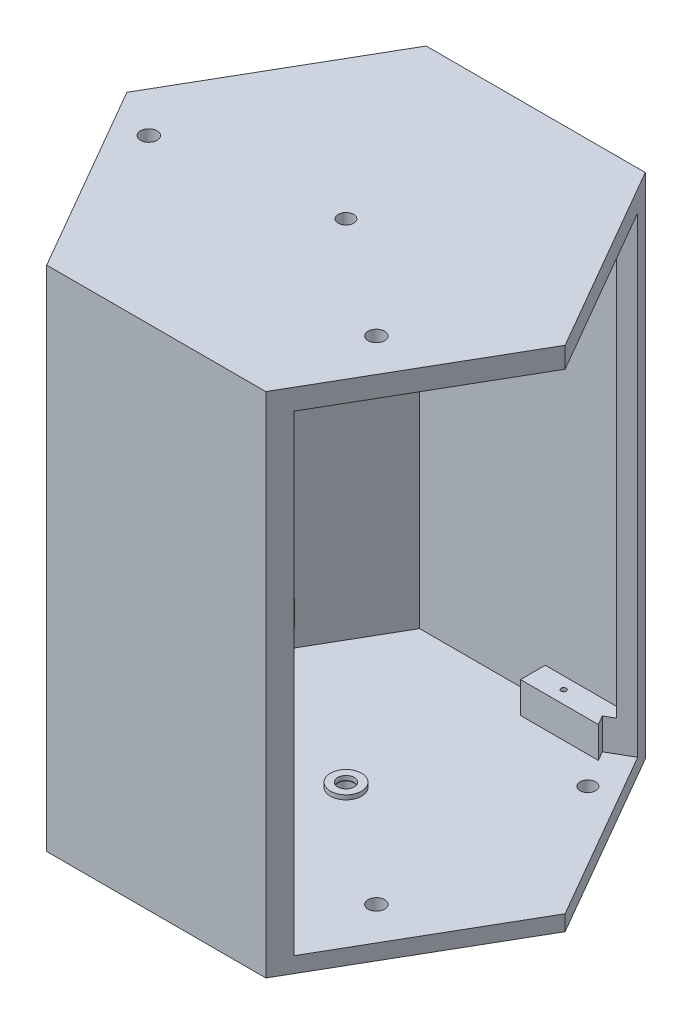
from build123d import *

# Parameters (mm, degrees)
SKETCH1_R                = 2.971068709
BOSS_EXTRUDE2_DEPTH      = 6
BOSS_EXTRUDE3_DEPTH      = 190
SKETCH3_R                = 2.971068709
BOSS_EXTRUDE5_DEPTH      = 6
SKETCH4_W                = 12.5
SKETCH4_H                = 10
BOSS_EXTRUDE6_DEPTH      = 11
SKETCH5_R                = 1
BOSS_EXTRUDE8_DEPTH      = 18
SKETCH5_2_R              = 1
CUT_EXTRUDE2_DEPTH       = 18
SKETCH7_R                = 6
SKETCH7_R_2              = 3.2
BOSS_EXTRUDE9_DEPTH      = 7.7
BOSS_EXTRUDE10_START     = -7.7
SKETCH8_R                = 6
SKETCH8_R_2              = 3.2
BOSS_EXTRUDE10_DEPTH     = 7.7
SKETCH9_W                = 182
SKETCH9_H                = 76.559305207
CUT_EXTRUDE3_DEPTH       = 6
SKETCH11_W               = 29
SKETCH11_H               = 25
CUT_EXTRUDE5_DEPTH       = 6
SKETCH12_W               = 29
SKETCH12_H               = 25
CUT_EXTRUDE6_DEPTH       = 6
SKETCH13_R               = 3.2
SKETCH13_R_2             = 3
CUT_EXTRUDE7_DEPTH       = 6
SKETCH14_R               = 3.2
CUT_EXTRUDE8_DEPTH       = 1273.798581799
SKETCH15_R               = 1
CUT_EXTRUDE9_DEPTH       = 11
SKETCH17_R               = 3
CUT_EXTRUDE11_DEPTH      = 170
CUT_EXTRUDE13_DEPTH      = 1271.151262578
CUT_EXTRUDE13_DEPTH_BACK = 1271.151262578
SKETCH19_R               = 3.2
SKETCH20_W               = 182
SKETCH20_H               = 76.559305207
CUT_EXTRUDE14_DEPTH      = 10


with BuildPart() as part:
    # Sketch1 → Boss-Extrude2 (new body)
    with BuildSketch(Plane(origin=(0, 0, 0), x_dir=(1, 0, 0), z_dir=(0, 1, 0))):
        Polygon((-40.573914373, 73.899203379), (-82.853566976, 0.668696943), (-40.573914373, -72.561809493), (43.985390835, -72.561809493), (86.265043438, 0.668696943), (43.985390835, 73.899203379), align=None)
        with Locations(Location((1.705738231, 0.668696943, 0), (0, 0, 270))):
            Circle(SKETCH1_R, mode=Mode.SUBTRACT)
    extrude(amount=BOSS_EXTRUDE2_DEPTH)

    # Sketch1<3> → Boss-Extrude3 (add)
    with BuildSketch(Plane(origin=(0, 0, 0), x_dir=(1, 0, 0), z_dir=(0, 1, 0))):
        Polygon((86.265043438, 0.668696943), (43.985390835, 73.899203379), (-40.573914373, 73.899203379), (-82.853566976, 0.668696943), (-40.573914373, -72.561809493), (43.985390835, -72.561809493), align=None)
        Polygon((-37.109812757, 67.899203379), (-75.925363746, 0.668696943), (-37.109812757, -66.561809493), (40.521289219, -66.561809493), (79.336840208, 0.668696943), (40.521289219, 67.899203379), align=None, mode=Mode.SUBTRACT)
    extrude(amount=BOSS_EXTRUDE3_DEPTH)

    # Sketch3 → Boss-Extrude5 (add)
    with BuildSketch(Plane(origin=(0, 190, 0), x_dir=(1, 0, 0), z_dir=(0, 1, 0))):
        Polygon((86.265043438, 0.668696943), (43.985390835, 73.899203379), (-40.573914373, 73.899203379), (-82.853566976, 0.668696943), (-40.573914373, -72.561809493), (43.985390835, -72.561809493), align=None)
        with Locations(Location((1.705738231, 0.668696943, 0), (0, 0, 270))):
            Circle(SKETCH3_R, mode=Mode.SUBTRACT)
    extrude(amount=BOSS_EXTRUDE5_DEPTH)

    # Sketch4 → Boss-Extrude6 (add)
    with BuildSketch(Plane(origin=(-62.429729502, 0, -36.043821133), x_dir=(-0.5000000000000001, 0, 0.8660254037844386), z_dir=(-0.8660254037844386, 0, -0.5000000000000001))):
        with Locations((2.755177243, 21.3)):
            Rectangle(SKETCH4_W, SKETCH4_H)
    extrude(amount=-BOSS_EXTRUDE6_DEPTH)

    # Sketch5 → Boss-Extrude8 (add)
    with BuildSketch(Plane.XZ):
        Polygon((40.521289219, -67.899203379), (11.391049027, -67.899203379), (11.391049027, -58.334458752), (46.043497104, -58.334458752), align=None)
        with Locations(Location((23.091264622, -63.273901871, 0), (0, 0, 270))):
            Circle(SKETCH5_R, mode=Mode.SUBTRACT)
    extrude(amount=-BOSS_EXTRUDE8_DEPTH)

    # Sketch5<2> → Cut-Extrude2 (cut)
    with BuildSketch(Plane.XZ):
        with Locations(Location((23.091264622, -63.273901871, 0), (0, 0, 270))):
            Circle(SKETCH5_2_R)
    extrude(amount=-CUT_EXTRUDE2_DEPTH, mode=Mode.SUBTRACT)

    # Sketch7 → Boss-Extrude9 (add)
    with BuildSketch(Plane(origin=(0, 196, 0), x_dir=(1, 0, 0), z_dir=(0, 1, 0))):
        with Locations(Location((1.705738231, 0.668696943, 0), (0, 0, 270))):
            Circle(SKETCH7_R)
        with Locations(Location((1.705738231, 0.668696943, 0), (0, 0, 270))):
            Circle(SKETCH7_R_2, mode=Mode.SUBTRACT)
    extrude(amount=-BOSS_EXTRUDE9_DEPTH)

    # Sketch8 → Boss-Extrude10 (add)
    with BuildSketch(Plane.XZ.offset(BOSS_EXTRUDE10_START)):
        with Locations(Location((1.705738231, -0.668696943, 0), (0, 0, 90))):
            Circle(SKETCH8_R)
        with Locations(Location((1.705738231, -0.668696943, 0), (0, 0, 90))):
            Circle(SKETCH8_R_2, mode=Mode.SUBTRACT)
    extrude(amount=BOSS_EXTRUDE10_DEPTH)

    # Sketch9 → Cut-Extrude3 (cut)
    with BuildSketch(Plane(origin=(629.826957164, 1366.496608068, -942.145548576), x_dir=(0, -1, 0), z_dir=(-0.8660254037844386, 0, -0.5000000000000003))):
        with Locations((1269.496608068, 1125.403480057)):
            Rectangle(SKETCH9_W, SKETCH9_H)
    extrude(amount=CUT_EXTRUDE3_DEPTH, mode=Mode.SUBTRACT)

    # Sketch11 → Cut-Extrude5 (cut)
    with BuildSketch(Plane(origin=(508.18415178, 1366.496608068, 1023.038661132), x_dir=(0, 1, 0), z_dir=(-0.8660254037844386, 0, 0.5000000000000001))):
        with Locations((-1345.996608068, 1169.575437511)):
            Rectangle(SKETCH11_W, SKETCH11_H)
    extrude(amount=-CUT_EXTRUDE5_DEPTH, mode=Mode.SUBTRACT)

    # Sketch12 → Cut-Extrude6 (cut)
    with BuildSketch(Plane(origin=(-287.090468893, 1366.496608068, 353.079993957), x_dir=(0, 1, 0), z_dir=(-0.8660254037844386, 0, -0.5000000000000001))):
        with Locations((-1345.996608068, 420.973803834)):
            Rectangle(SKETCH12_W, SKETCH12_H)
    extrude(amount=-CUT_EXTRUDE6_DEPTH, mode=Mode.SUBTRACT)

    # Sketch13 → Cut-Extrude7 (cut)
    with BuildSketch(Plane(origin=(690.748066702, 0, 917.635335707), x_dir=(-1, 0, 0), z_dir=(0, -1, 0))):
        with Locations(Location((754.924695238, 908.078431268, 0), (0, 0, 90))):
            Circle(SKETCH13_R)
        with Locations(Location((644.015452413, 885.008681135, 0), (0, 0, 90))):
            Circle(SKETCH13_R)
        with Locations(Location((642.689368477, 965.287041279, 0), (0, 0, 90))):
            Circle(SKETCH13_R_2)
    extrude(amount=-CUT_EXTRUDE7_DEPTH, mode=Mode.SUBTRACT)

    # Sketch14 → Cut-Extrude8 (cut, through all)
    with BuildSketch(Plane(origin=(690.748066702, 0, 917.635335707), x_dir=(-1, 0, 0), z_dir=(0, -1, 0))):
        with Locations(Location((644.015452413, 885.008681135, 0), (0, 0, 90))):
            Circle(SKETCH14_R)
    extrude(amount=-CUT_EXTRUDE8_DEPTH, mode=Mode.SUBTRACT)

    # Sketch15 → Cut-Extrude9 (cut)
    with BuildSketch(Plane(origin=(690.748066702, 16.3, 917.635335707), x_dir=(-1, 0, 0), z_dir=(0, -1, 0))):
        with Locations(Location((747.475715997, 946.555449467, 0), (0, 0, 90))):
            Circle(SKETCH15_R)
    extrude(amount=-CUT_EXTRUDE9_DEPTH, mode=Mode.SUBTRACT)

    # Sketch17 → Cut-Extrude11 (cut)
    with BuildSketch(Plane(origin=(690.748066702, 198, 917.635335707), x_dir=(1, 0, 0), z_dir=(0, 1, 0))):
        with Locations(Location((-754.924695238, 908.078431268, 0), (0, 0, 270))):
            Circle(SKETCH17_R)
    extrude(amount=-CUT_EXTRUDE11_DEPTH, mode=Mode.SUBTRACT)

    # Sketch19 → Cut-Extrude13 (cut, two sides: drawn at the far end of the back side and taken through both)
    with BuildSketch(Plane(origin=(690.748066702, 18, 917.635335707), x_dir=(-1, 0, 0), z_dir=(0, -1, 0)).offset(-CUT_EXTRUDE13_DEPTH_BACK)):
        with Locations(Location((754.924695238, 908.078431268, 0), (0, 0, 90))):
            Circle(SKETCH19_R)
    extrude(amount=CUT_EXTRUDE13_DEPTH + CUT_EXTRUDE13_DEPTH_BACK, mode=Mode.SUBTRACT)

    # Sketch20 → Cut-Extrude14 (cut)
    with BuildSketch(Plane(origin=(-165.447663504, 1366.496608068, -436.647894277), x_dir=(0, -1, 0), z_dir=(-0.8660254037844385, 0, 0.5000000000000002))):
        with Locations((1269.496608068, 465.14576128)):
            Rectangle(SKETCH20_W, SKETCH20_H)
    extrude(amount=CUT_EXTRUDE14_DEPTH, mode=Mode.SUBTRACT)


solid = part.part
